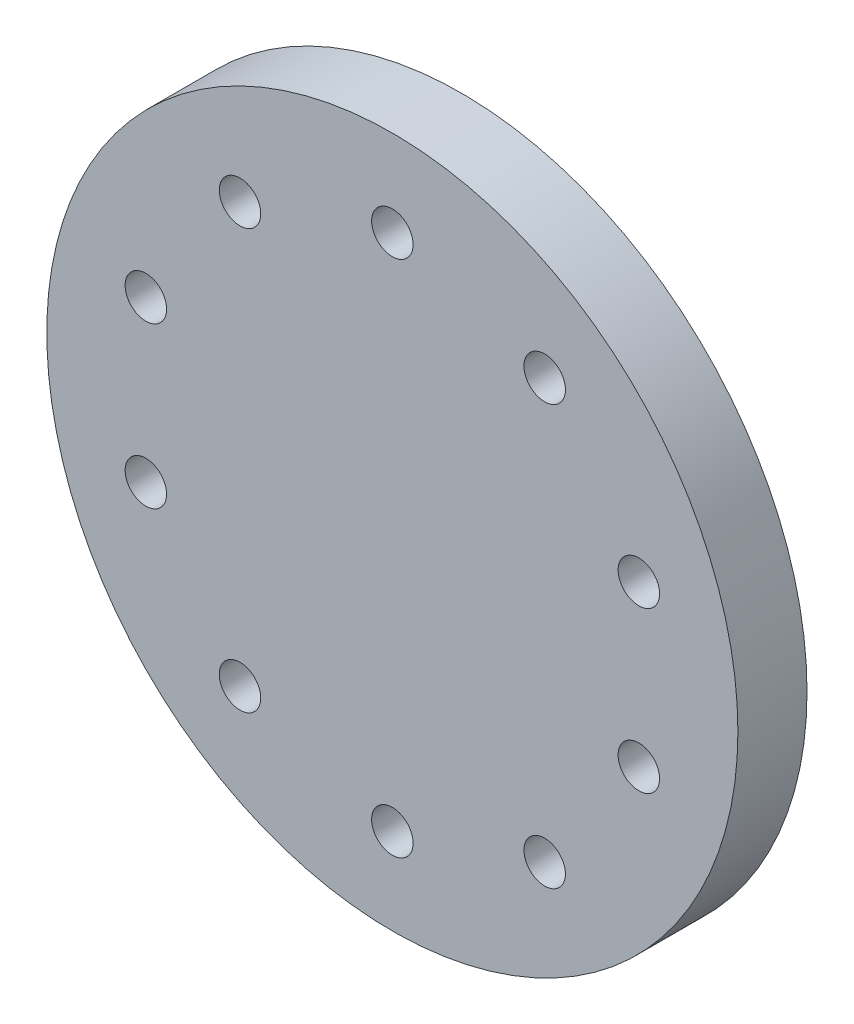
from build123d import *

# Parameters (mm, degrees)
SKETCH_1_R      = 10
SKETCH_1_R_2    = 0.6
EXTRUDE_1_DEPTH = 2
SKETCH_2_R      = 1.5
EXTRUDE_2_DEPTH = 3


with BuildPart() as part:
    # 草圖1 → 填料-伸長1 (new body)
    with BuildSketch(Plane.XY):
        Circle(SKETCH_1_R)
        with Locations((4.408389392, 6.067627458)):
            Circle(SKETCH_1_R_2, mode=Mode.SUBTRACT)
        with Locations((0, 7.5)):
            Circle(SKETCH_1_R_2, mode=Mode.SUBTRACT)
        with Locations((7.132923872, 2.317627458)):
            Circle(SKETCH_1_R_2, mode=Mode.SUBTRACT)
        with Locations((7.132923872, -2.317627458)):
            Circle(SKETCH_1_R_2, mode=Mode.SUBTRACT)
        with Locations((4.408389392, -6.067627458)):
            Circle(SKETCH_1_R_2, mode=Mode.SUBTRACT)
        with Locations((0, -7.5)):
            Circle(SKETCH_1_R_2, mode=Mode.SUBTRACT)
        with Locations((-4.408389392, -6.067627458)):
            Circle(SKETCH_1_R_2, mode=Mode.SUBTRACT)
        with Locations((-7.132923872, -2.317627458)):
            Circle(SKETCH_1_R_2, mode=Mode.SUBTRACT)
        with Locations((-7.132923872, 2.317627458)):
            Circle(SKETCH_1_R_2, mode=Mode.SUBTRACT)
        with Locations((-4.408389392, 6.067627458)):
            Circle(SKETCH_1_R_2, mode=Mode.SUBTRACT)
    extrude(amount=EXTRUDE_1_DEPTH)

    # 草圖2 → 填料-伸長2 (add)
    with BuildSketch(Plane(origin=(0, 0, 0), x_dir=(-1, 0, 0), z_dir=(0, 0, -1))):
        with Locations(Location((0, 0, 0), (0, 0, 180))):
            Circle(SKETCH_2_R)
    extrude(amount=EXTRUDE_2_DEPTH)


solid = part.part
